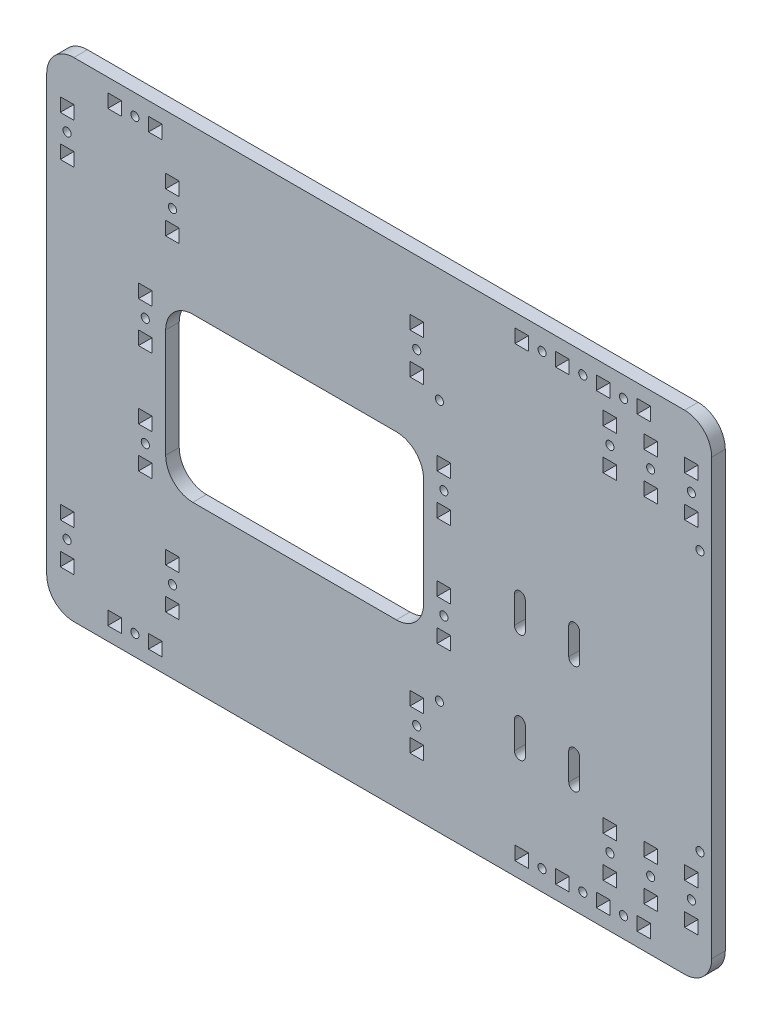
from build123d import *

# Parameters (mm, degrees)
SKETCH1_W           = 245.000446045
SKETCH1_H           = 180
SKETCH1_R           = 1.5
SKETCH1_W_2         = 95
SKETCH1_H_2         = 60
SKETCH1_W_3         = 5
SKETCH1_H_3         = 5
BOSS_EXTRUDE1_DEPTH = 5
FILLET1_R           = 10


with BuildPart() as part:
    # Sketch1 → Boss-Extrude1 (new body)
    with BuildSketch(Plane.XY):
        with Locations((31.175821468, 0)):
            Rectangle(SKETCH1_W, SKETCH1_H)
        with Locations((53.355041852, 48)):
            Circle(SKETCH1_R, mode=Mode.SUBTRACT)
        with Locations((149.355041852, 48)):
            Circle(SKETCH1_R, mode=Mode.SUBTRACT)
        with Locations((149.355041852, -48)):
            Circle(SKETCH1_R, mode=Mode.SUBTRACT)
        with Locations((53.355041852, -48)):
            Circle(SKETCH1_R, mode=Mode.SUBTRACT)
        with Locations((-58.824847601, 82.5)):
            Circle(SKETCH1_R, mode=Mode.SUBTRACT)
        with Locations((106.17604449, 82.5)):
            Circle(SKETCH1_R, mode=Mode.SUBTRACT)
        with Locations((106.17604449, -82.5)):
            Circle(SKETCH1_R, mode=Mode.SUBTRACT)
        with Locations((-58.824847601, -82.5)):
            Circle(SKETCH1_R, mode=Mode.SUBTRACT)
        with Locations((55, 20)):
            Circle(SKETCH1_R, mode=Mode.SUBTRACT)
        with Locations((-55, 20)):
            Circle(SKETCH1_R, mode=Mode.SUBTRACT)
        with Locations((55, -20)):
            Circle(SKETCH1_R, mode=Mode.SUBTRACT)
        with Locations((-55, -20)):
            Circle(SKETCH1_R, mode=Mode.SUBTRACT)
        with Locations((45, 60)):
            Circle(SKETCH1_R, mode=Mode.SUBTRACT)
        with Locations((-45, 60)):
            Circle(SKETCH1_R, mode=Mode.SUBTRACT)
        with Locations((45, -60)):
            Circle(SKETCH1_R, mode=Mode.SUBTRACT)
        with Locations((-45, -60)):
            Circle(SKETCH1_R, mode=Mode.SUBTRACT)
        with Locations((91.176044481, 82.5)):
            Circle(SKETCH1_R, mode=Mode.SUBTRACT)
        with Locations((121.17604449, 82.5)):
            Circle(SKETCH1_R, mode=Mode.SUBTRACT)
        with Locations((91.17604449, -82.5)):
            Circle(SKETCH1_R, mode=Mode.SUBTRACT)
        with Locations((121.17604449, -82.5)):
            Circle(SKETCH1_R, mode=Mode.SUBTRACT)
        with Locations((-83.824401555, 65)):
            Circle(SKETCH1_R, mode=Mode.SUBTRACT)
        with Locations((-83.824401555, -65)):
            Circle(SKETCH1_R, mode=Mode.SUBTRACT)
        with Locations((146.17604449, 65)):
            Circle(SKETCH1_R, mode=Mode.SUBTRACT)
        with Locations((146.17604449, -65)):
            Circle(SKETCH1_R, mode=Mode.SUBTRACT)
        with Locations((131.17604449, -65)):
            Circle(SKETCH1_R, mode=Mode.SUBTRACT)
        with Locations((116.17604449, -65)):
            Circle(SKETCH1_R, mode=Mode.SUBTRACT)
        with Locations((131.17604449, 65)):
            Circle(SKETCH1_R, mode=Mode.SUBTRACT)
        with Locations((116.17604449, 65)):
            Circle(SKETCH1_R, mode=Mode.SUBTRACT)
        Rectangle(SKETCH1_W_2, SKETCH1_H_2, mode=Mode.SUBTRACT)
        with BuildLine():
            Line((101, -10), (101, 0))
            ThreePointArc((101, 0), (103, 2), (105, 0))
            Line((105, 0), (105, -10))
            ThreePointArc((105, -10), (103, -12), (101, -10))
        make_face(mode=Mode.SUBTRACT)
        with BuildLine():
            Line((81, -10), (81, 0))
            ThreePointArc((81, 0), (83, 2), (85, 0))
            Line((85, 0), (85, -10))
            ThreePointArc((85, -10), (83, -12), (81, -10))
        make_face(mode=Mode.SUBTRACT)
        with BuildLine():
            Line((81, -50), (81, -40))
            ThreePointArc((81, -40), (83, -38), (85, -40))
            Line((85, -40), (85, -50))
            ThreePointArc((85, -50), (83, -52), (81, -50))
        make_face(mode=Mode.SUBTRACT)
        with BuildLine():
            Line((101, -50), (101, -40))
            ThreePointArc((101, -40), (103, -38), (105, -40))
            Line((105, -40), (105, -50))
            ThreePointArc((105, -50), (103, -52), (101, -50))
        make_face(mode=Mode.SUBTRACT)
        with Locations((-66.324847601, 82.5)):
            Rectangle(SKETCH1_W_3, SKETCH1_H_3, mode=Mode.SUBTRACT)
        with Locations((-51.324847601, 82.5)):
            Rectangle(SKETCH1_W_3, SKETCH1_H_3, mode=Mode.SUBTRACT)
        with Locations((113.67604449, 82.5)):
            Rectangle(SKETCH1_W_3, SKETCH1_H_3, mode=Mode.SUBTRACT)
        with Locations((98.67604449, 82.5)):
            Rectangle(SKETCH1_W_3, SKETCH1_H_3, mode=Mode.SUBTRACT)
        with Locations((113.67604449, -82.5)):
            Rectangle(SKETCH1_W_3, SKETCH1_H_3, mode=Mode.SUBTRACT)
        with Locations((98.67604449, -82.5)):
            Rectangle(SKETCH1_W_3, SKETCH1_H_3, mode=Mode.SUBTRACT)
        with Locations((-66.324847601, -82.5)):
            Rectangle(SKETCH1_W_3, SKETCH1_H_3, mode=Mode.SUBTRACT)
        with Locations((-51.324847601, -82.5)):
            Rectangle(SKETCH1_W_3, SKETCH1_H_3, mode=Mode.SUBTRACT)
        with Locations((55, 27.5)):
            Rectangle(SKETCH1_W_3, SKETCH1_H_3, mode=Mode.SUBTRACT)
        with Locations((55, 12.5)):
            Rectangle(SKETCH1_W_3, SKETCH1_H_3, mode=Mode.SUBTRACT)
        with Locations((-55, 27.5)):
            Rectangle(SKETCH1_W_3, SKETCH1_H_3, mode=Mode.SUBTRACT)
        with Locations((-55, 12.5)):
            Rectangle(SKETCH1_W_3, SKETCH1_H_3, mode=Mode.SUBTRACT)
        with Locations((55, -27.5)):
            Rectangle(SKETCH1_W_3, SKETCH1_H_3, mode=Mode.SUBTRACT)
        with Locations((55, -12.5)):
            Rectangle(SKETCH1_W_3, SKETCH1_H_3, mode=Mode.SUBTRACT)
        with Locations((-55, -27.5)):
            Rectangle(SKETCH1_W_3, SKETCH1_H_3, mode=Mode.SUBTRACT)
        with Locations((-55, -12.5)):
            Rectangle(SKETCH1_W_3, SKETCH1_H_3, mode=Mode.SUBTRACT)
        with Locations((45, 67.5)):
            Rectangle(SKETCH1_W_3, SKETCH1_H_3, mode=Mode.SUBTRACT)
        with Locations((45, 52.5)):
            Rectangle(SKETCH1_W_3, SKETCH1_H_3, mode=Mode.SUBTRACT)
        with Locations((-45, 67.5)):
            Rectangle(SKETCH1_W_3, SKETCH1_H_3, mode=Mode.SUBTRACT)
        with Locations((-45, 52.5)):
            Rectangle(SKETCH1_W_3, SKETCH1_H_3, mode=Mode.SUBTRACT)
        with Locations((45, -67.5)):
            Rectangle(SKETCH1_W_3, SKETCH1_H_3, mode=Mode.SUBTRACT)
        with Locations((45, -52.5)):
            Rectangle(SKETCH1_W_3, SKETCH1_H_3, mode=Mode.SUBTRACT)
        with Locations((-45, -67.5)):
            Rectangle(SKETCH1_W_3, SKETCH1_H_3, mode=Mode.SUBTRACT)
        with Locations((-45, -52.5)):
            Rectangle(SKETCH1_W_3, SKETCH1_H_3, mode=Mode.SUBTRACT)
        with Locations((83.676044481, 82.5)):
            Rectangle(SKETCH1_W_3, SKETCH1_H_3, mode=Mode.SUBTRACT)
        with Locations((128.67604449, 82.5)):
            Rectangle(SKETCH1_W_3, SKETCH1_H_3, mode=Mode.SUBTRACT)
        with Locations((83.67604449, -82.5)):
            Rectangle(SKETCH1_W_3, SKETCH1_H_3, mode=Mode.SUBTRACT)
        with Locations((128.67604449, -82.5)):
            Rectangle(SKETCH1_W_3, SKETCH1_H_3, mode=Mode.SUBTRACT)
        with Locations((-83.824401555, 72.5)):
            Rectangle(SKETCH1_W_3, SKETCH1_H_3, mode=Mode.SUBTRACT)
        with Locations((-83.824401555, 57.5)):
            Rectangle(SKETCH1_W_3, SKETCH1_H_3, mode=Mode.SUBTRACT)
        with Locations((-83.824401555, -57.5)):
            Rectangle(SKETCH1_W_3, SKETCH1_H_3, mode=Mode.SUBTRACT)
        with Locations((-83.824401555, -72.5)):
            Rectangle(SKETCH1_W_3, SKETCH1_H_3, mode=Mode.SUBTRACT)
        with Locations((146.17604449, 72.5)):
            Rectangle(SKETCH1_W_3, SKETCH1_H_3, mode=Mode.SUBTRACT)
        with Locations((146.17604449, 57.5)):
            Rectangle(SKETCH1_W_3, SKETCH1_H_3, mode=Mode.SUBTRACT)
        with Locations((146.17604449, -57.5)):
            Rectangle(SKETCH1_W_3, SKETCH1_H_3, mode=Mode.SUBTRACT)
        with Locations((146.17604449, -72.5)):
            Rectangle(SKETCH1_W_3, SKETCH1_H_3, mode=Mode.SUBTRACT)
        with Locations((131.17604449, -57.5)):
            Rectangle(SKETCH1_W_3, SKETCH1_H_3, mode=Mode.SUBTRACT)
        with Locations((131.17604449, -72.5)):
            Rectangle(SKETCH1_W_3, SKETCH1_H_3, mode=Mode.SUBTRACT)
        with Locations((116.17604449, -57.5)):
            Rectangle(SKETCH1_W_3, SKETCH1_H_3, mode=Mode.SUBTRACT)
        with Locations((116.17604449, -72.5)):
            Rectangle(SKETCH1_W_3, SKETCH1_H_3, mode=Mode.SUBTRACT)
        with Locations((131.17604449, 72.5)):
            Rectangle(SKETCH1_W_3, SKETCH1_H_3, mode=Mode.SUBTRACT)
        with Locations((131.17604449, 57.5)):
            Rectangle(SKETCH1_W_3, SKETCH1_H_3, mode=Mode.SUBTRACT)
        with Locations((116.17604449, 72.5)):
            Rectangle(SKETCH1_W_3, SKETCH1_H_3, mode=Mode.SUBTRACT)
        with Locations((116.17604449, 57.5)):
            Rectangle(SKETCH1_W_3, SKETCH1_H_3, mode=Mode.SUBTRACT)
    extrude(amount=BOSS_EXTRUDE1_DEPTH)

    # Fillet1
    fillet1_edges = [part.edges().sort_by_distance(p)[0] for p in [
        (-47.5, 30, 2.5),
        (-47.5, -30, 2.5),
        (47.5, -30, 2.5),
        (47.5, 30, 2.5),
        (153.67604449, -90, 2.5),
        (-91.324401555, -90, 2.5),
        (-91.324401555, 90, 2.5),
        (153.67604449, 90, 2.5),
    ]]
    fillet(fillet1_edges, radius=FILLET1_R)


solid = part.part
